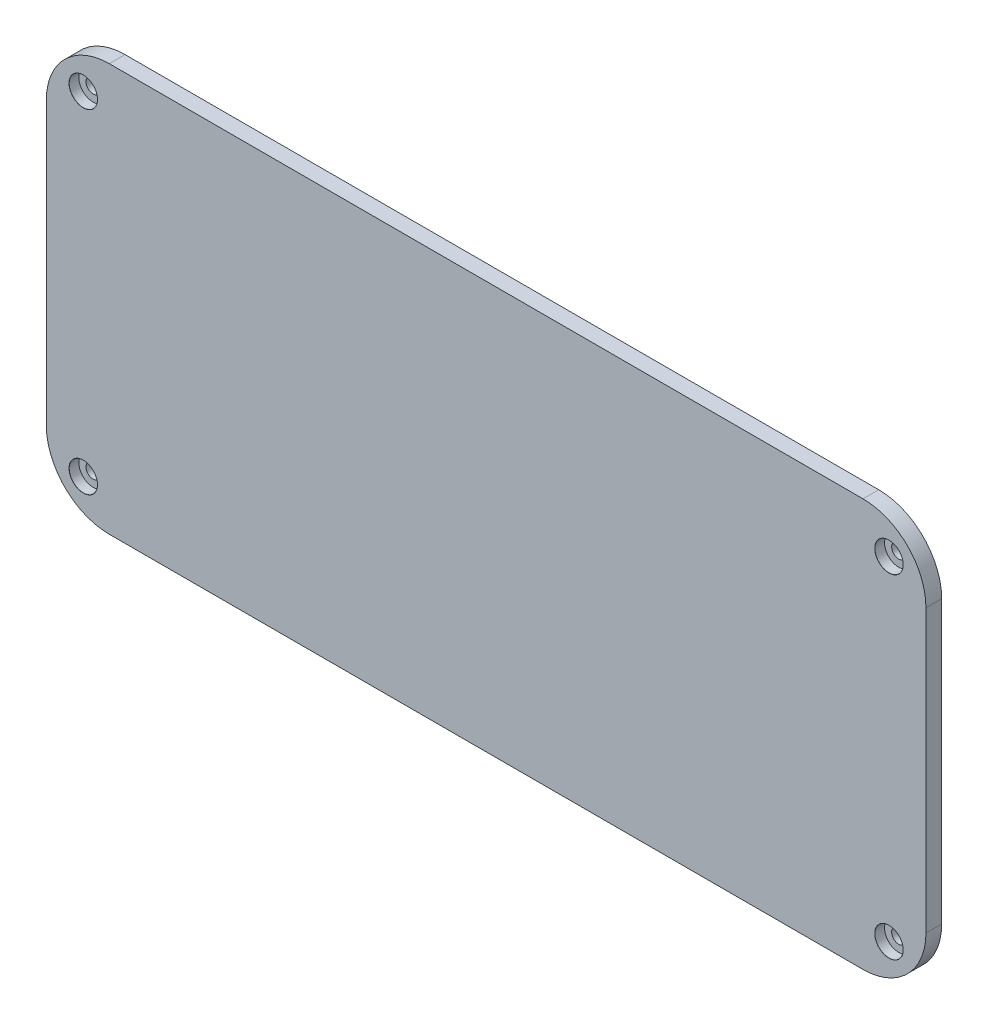
from build123d import *

# Parameters (mm, degrees)
BOSS_EXTRUDE1_DEPTH                           = 5
CBORE_FOR_M4_PAN_HEAD_MACHINE_SCREW1_AT_COUNT = 2
CBORE_FOR_M4_PAN_HEAD_MACHINE_SCREW1_AT_PITCH = 106
CBORE_FOR_M4_PAN_HEAD_MACHINE_SCREW1_2_COUNT  = 2
CBORE_FOR_M4_PAN_HEAD_MACHINE_SCREW1_2_PITCH  = 256
CBORE_FOR_M4_PAN_HEAD_MACHINE_SCREW1_3_COUNT  = 2
CBORE_FOR_M4_PAN_HEAD_MACHINE_SCREW1_3_PITCH  = 277.077606457
SKETCH4_W                                     = 95.5
SKETCH4_H                                     = 75.5
SKETCH4_W_2                                   = 75.5
SKETCH4_H_2                                   = 55.5
BOSS_EXTRUDE2_DEPTH                           = 10


with BuildPart() as part:
    # Sketch1 → Boss-Extrude1 (new body)
    with BuildSketch(Plane.XY):
        with BuildLine():
            Line((-119.75, 64.75), (119.75, 64.75))
            ThreePointArc((119.75, 64.75), (133.892135624, 58.892135624), (139.75, 44.75))
            Line((139.75, 44.75), (139.75, -44.75))
            ThreePointArc((139.75, -44.75), (133.892135624, -58.892135624), (119.75, -64.75))
            Line((119.75, -64.75), (-119.75, -64.75))
            ThreePointArc((-119.75, -64.75), (-133.892135624, -58.892135624), (-139.75, -44.75))
            Line((-139.75, -44.75), (-139.75, 44.75))
            ThreePointArc((-139.75, 44.75), (-133.892135624, 58.892135624), (-119.75, 64.75))
        make_face()
    extrude(amount=BOSS_EXTRUDE1_DEPTH)

    # Sketch3 → CBORE for M4 Pan Head Machine Screw1 (revolve, cut)
    with BuildSketch(Plane(origin=(-128, 53, 5), x_dir=(0, -1, 0), z_dir=(1, 0, 0))):
        Polygon((0, 0), (0, 31.351936393), (2.25, 30), (2.25, 3.1), (4.5, 3.1), (4.5, 0.025), (4.525, 0), align=None)
    cbore_for_m4_pan_head_machine_screw1 = revolve(axis=Axis((-128, 53, 11.35), (0, 0, -1)), mode=Mode.SUBTRACT)

    # CBORE for M4 Pan Head Machine Screw1 at: CBORE for M4 Pan Head Machine Screw1 ×2
    with Locations(*[(0, -i * CBORE_FOR_M4_PAN_HEAD_MACHINE_SCREW1_AT_PITCH, 0) for i in range(1, CBORE_FOR_M4_PAN_HEAD_MACHINE_SCREW1_AT_COUNT)]):
        add(cbore_for_m4_pan_head_machine_screw1, mode=Mode.SUBTRACT)

    # CBORE for M4 Pan Head Machine Screw1 2: CBORE for M4 Pan Head Machine Screw1 ×2
    with Locations(*[(i * CBORE_FOR_M4_PAN_HEAD_MACHINE_SCREW1_2_PITCH, 0, 0) for i in range(1, CBORE_FOR_M4_PAN_HEAD_MACHINE_SCREW1_2_COUNT)]):
        add(cbore_for_m4_pan_head_machine_screw1, mode=Mode.SUBTRACT)

    # CBORE for M4 Pan Head Machine Screw1 3: CBORE for M4 Pan Head Machine Screw1 ×2
    with Locations(*[Vector(0.9239288705910963, -0.38256429797912583, 0) * (i * CBORE_FOR_M4_PAN_HEAD_MACHINE_SCREW1_3_PITCH) for i in range(1, CBORE_FOR_M4_PAN_HEAD_MACHINE_SCREW1_3_COUNT)]):
        add(cbore_for_m4_pan_head_machine_screw1, mode=Mode.SUBTRACT)

    # Sketch4 → Boss-Extrude2 (add)
    with BuildSketch(Plane(origin=(0, 0, 0), x_dir=(-1, 0, 0), z_dir=(0, 0, -1))):
        Rectangle(SKETCH4_W, SKETCH4_H)
        Rectangle(SKETCH4_W_2, SKETCH4_H_2, mode=Mode.SUBTRACT)
    extrude(amount=BOSS_EXTRUDE2_DEPTH)


solid = part.part
